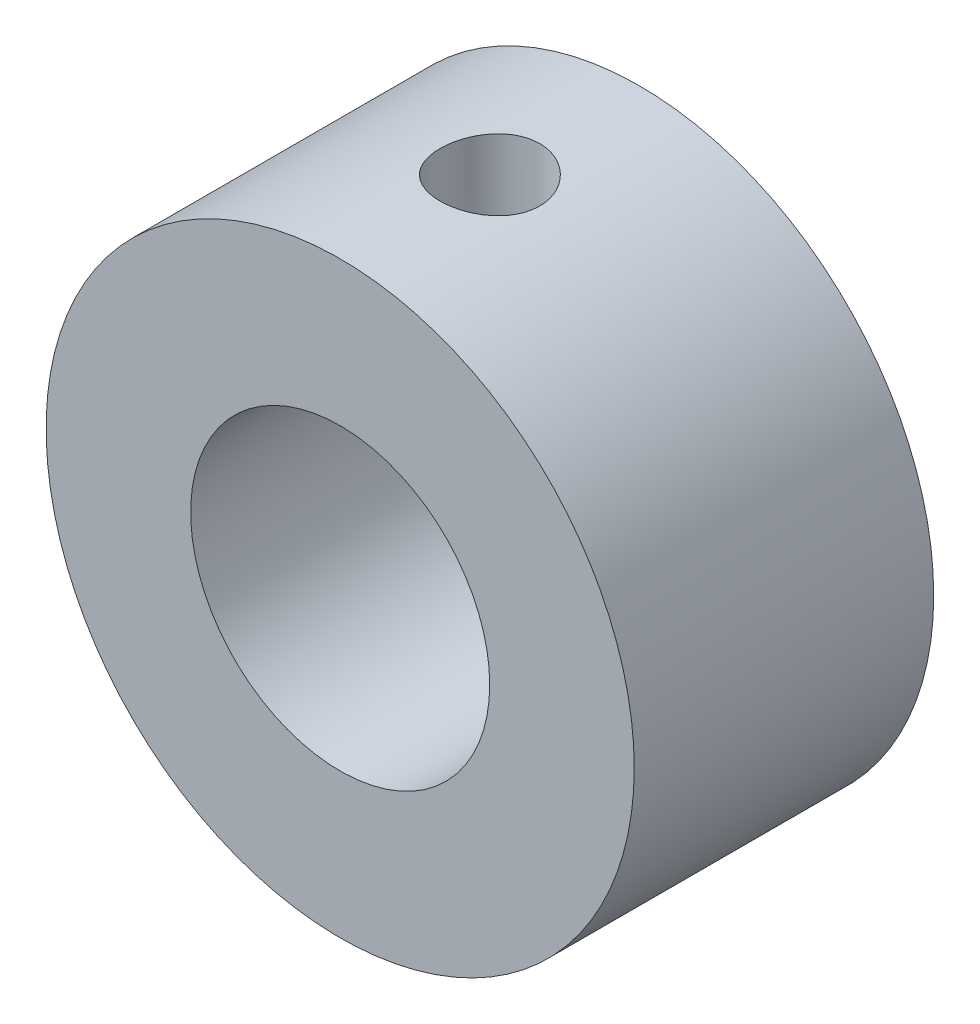
from build123d import *

# Parameters (mm, degrees)
SKETCH1_R               = 9.36625
SKETCH1_R_2             = 4.7625
BOSS_EXTRUDE1_DEPTH     = 9.5377
CUT_EXTRUDE1_REACH      = 25.013
CUT_EXTRUDE1_END_RADIUS = 4.7625
SKETCH3_R               = 1.5875


with BuildPart() as part:
    # Sketch1 → Boss-Extrude1 (new body)
    with BuildSketch(Plane.XY):
        Circle(SKETCH1_R)
        Circle(SKETCH1_R_2, mode=Mode.SUBTRACT)
    extrude(amount=BOSS_EXTRUDE1_DEPTH)

    # Cut-Extrude1: up to this cylinder (the profile starts outside it)
    cut_extrude1_end = Plane(origin=(0, 0, 4.76885), z_dir=(0, 0, -1)) * Cylinder(CUT_EXTRUDE1_END_RADIUS, 60.551, mode=Mode.PRIVATE)
    # Sketch3 → Cut-Extrude1 (cut, up to the surface)
    with BuildSketch(Plane(origin=(0, 9.36625, 0), x_dir=(1, 0, 0), z_dir=(0, 1, 0)), mode=Mode.PRIVATE) as cut_extrude1_sk1:
        with Locations(Location((0, -4.76885, 0), (0, 0, 270))):
            Circle(SKETCH3_R)
    cut_extrude1_tool1 = extrude(cut_extrude1_sk1.sketch, amount=-CUT_EXTRUDE1_REACH, mode=Mode.PRIVATE) - cut_extrude1_end
    add(cut_extrude1_tool1.solids().sort_by_distance((0, 9.36625, 4.76885))[0], mode=Mode.SUBTRACT)


solid = part.part
